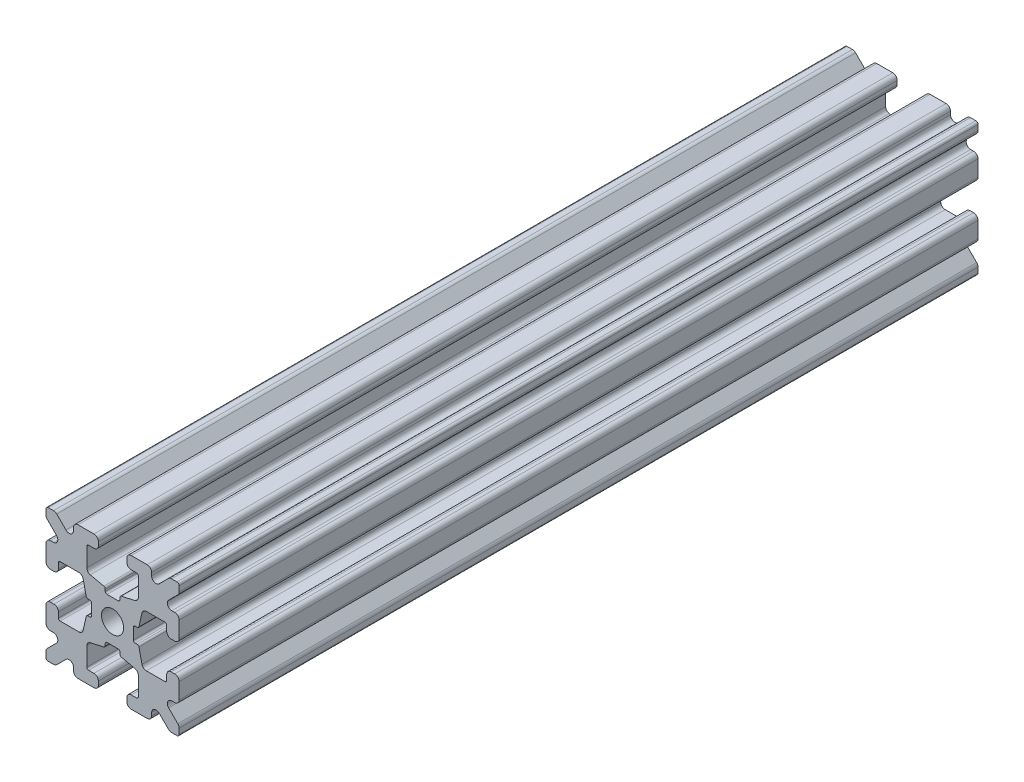
from build123d import *

# Parameters (mm, degrees)
SKETCH1_W           = 15
SKETCH1_H           = 15
SKETCH1_R           = 1.25
BOSS_EXTRUDE1_DEPTH = 45
FILLET1_R           = 0.25
CUT_EXTRUDE1_DEPTH  = 91.622844802
CUT_EXTRUDE3_DEPTH  = 91.622844802
FILLET3_R           = 0.5
FILLET4_R           = 0.5
FILLET5_R           = 3
FILLET6_R           = 0.2
CUT_EXTRUDE4_DEPTH  = 91.622844802
FILLET8_R           = 0.5
SKETCH6_W           = 5.1529354
SKETCH6_H           = 1.651
SKETCH6_W_2         = 1.651
SKETCH6_H_2         = 5.1529354
CUT_EXTRUDE5_DEPTH  = 91.622844802
FILLET10_R          = 0.2


with BuildPart() as part:
    # Sketch1 → Boss-Extrude1 (new, symmetric)
    with BuildSketch(Plane.XY):
        Rectangle(SKETCH1_W, SKETCH1_H)
        Circle(SKETCH1_R, mode=Mode.SUBTRACT)
    extrude(amount=BOSS_EXTRUDE1_DEPTH, both=True)

    # Fillet1
    fillet1_edges = [part.edges().sort_by_distance(p)[0] for p in [
        (7.5, -7.5, 0),
        (-7.5, -7.5, 0),
        (-7.5, 7.5, 0),
        (7.5, 7.5, 0),
    ]]
    fillet(fillet1_edges, radius=FILLET1_R)

    # Sketch2 → Cut-Extrude1 (cut, through all)
    with BuildSketch(Plane.XY.offset(45)):
        Polygon((-7.5, 1.6), (-6.1, 1.6), (-6.1, 2.9), (-3.4, 2.9), (-3.4, -2.9), (-6.1, -2.9), (-6.1, -1.6), (-7.5, -1.6), align=None)
        Polygon((2.9, 6.1), (1.6, 6.1), (1.6, 7.5), (-1.6, 7.5), (-1.6, 6.1), (-2.9, 6.1), (-2.9, 3.4), (2.9, 3.4), align=None)
        Polygon((-1.6, -7.5), (-1.6, -6.1), (-2.9, -6.1), (-2.9, -3.4), (2.9, -3.4), (2.9, -6.1), (1.6, -6.1), (1.6, -7.5), align=None)
        Polygon((6.1, -2.9), (6.1, -1.6), (7.5, -1.6), (7.5, 1.6), (6.1, 1.6), (6.1, 2.9), (3.4, 2.9), (3.4, -2.9), align=None)
    extrude(amount=-CUT_EXTRUDE1_DEPTH, mode=Mode.SUBTRACT)

    # Sketch4 → Cut-Extrude3 (cut, through all)
    with BuildSketch(Plane.XY.offset(45)):
        Polygon((-3.4, 2.9), (-2.75, 0), (-3.4, -2.9), align=None)
        Polygon((-2.9, 3.4), (0, 2.75), (2.9, 3.4), align=None)
        Polygon((3.4, 2.9), (2.75, 0), (3.4, -2.9), align=None)
        Polygon((-2.9, -3.4), (0, -2.75), (2.9, -3.4), align=None)
    extrude(amount=-CUT_EXTRUDE3_DEPTH, mode=Mode.SUBTRACT)

    # Fillet3
    fillet3_edges = [part.edges().sort_by_distance(p)[0] for p in [
        (1.6, -7.5, 0),
        (-1.6, -7.5, 0),
        (-1.6, -6.1, 0),
        (1.6, -6.1, 0),
        (6.1, 1.6, 0),
        (7.5, 1.6, 0),
        (7.5, -1.6, 0),
        (6.1, -1.6, 0),
        (-7.5, -1.6, 0),
        (-7.5, 1.6, 0),
        (-6.1, 1.6, 0),
        (-6.1, -1.6, 0),
        (-1.6, 6.1, 0),
        (-1.6, 7.5, 0),
        (1.6, 7.5, 0),
        (1.6, 6.1, 0),
    ]]
    fillet(fillet3_edges, radius=FILLET3_R)

    # Fillet4
    fillet4_edges = [part.edges().sort_by_distance(p)[0] for p in [
        (-2.9, -3.4, 0),
        (2.9, -3.4, 0),
        (3.4, -2.9, 0),
        (3.4, 2.9, 0),
        (-3.4, 2.9, 0),
        (-3.4, -2.9, 0),
        (2.9, 3.4, 0),
        (-2.9, 3.4, 0),
    ]]
    fillet(fillet4_edges, radius=FILLET4_R)

    # Fillet5
    fillet5_edges = [part.edges().sort_by_distance(p)[0] for p in [
        (-2.75, 0, 0),
        (0, 2.75, 0),
        (2.75, 0, 0),
        (0, -2.75, 0),
    ]]
    fillet(fillet5_edges, radius=FILLET5_R)

    # Fillet6
    fillet6_edges = [part.edges().sort_by_distance(p)[0] for p in [
        (-2.9, -6.1, 0),
        (2.9, -6.1, 0),
        (6.1, -2.9, 0),
        (6.1, 2.9, 0),
        (-6.1, 2.9, 0),
        (-6.1, -2.9, 0),
        (2.9, 6.1, 0),
        (-2.9, 6.1, 0),
    ]]
    fillet(fillet6_edges, radius=FILLET6_R)

    # Sketch5 → Cut-Extrude4 (cut, through all)
    with BuildSketch(Plane.XY.offset(45)):
        Polygon((-7.5, 6.439339828), (-5.460660172, 4.4), (-7.5, 4.4), align=None)
        Polygon((-6.439339828, 7.5), (-4.4, 5.460660172), (-4.4, 7.5), align=None)
        Polygon((4.4, 7.5), (6.439339828, 7.5), (4.4, 5.460660172), align=None)
        Polygon((7.5, 6.439339828), (7.5, 4.4), (5.460660172, 4.4), align=None)
        Polygon((7.5, -6.439339828), (5.460660172, -4.4), (7.5, -4.4), align=None)
        Polygon((6.439339828, -7.5), (4.4, -5.460660172), (4.4, -7.5), align=None)
        Polygon((-4.4, -7.5), (-6.439339828, -7.5), (-4.4, -5.460660172), align=None)
        Polygon((-7.5, -6.439339828), (-7.5, -4.4), (-5.460660172, -4.4), align=None)
    extrude(amount=-CUT_EXTRUDE4_DEPTH, mode=Mode.SUBTRACT)

    # Fillet8
    fillet8_edges = [part.edges().sort_by_distance(p)[0] for p in [
        (-7.5, 4.4, 0),
        (-7.5, 6.439339828, 0),
        (-5.460660172, 4.4, 0),
        (7.5, -4.4, 0),
        (7.5, -6.439339828, 0),
        (5.460660172, -4.4, 0),
        (5.460660172, 4.4, 0),
        (7.5, 6.439339828, 0),
        (7.5, 4.4, 0),
        (-4.4, 7.5, 0),
        (-4.4, 5.460660172, 0),
        (-6.439339828, 7.5, 0),
        (-5.460660172, -4.4, 0),
        (-7.5, -6.439339828, 0),
        (-7.5, -4.4, 0),
        (4.4, 5.460660172, 0),
        (4.4, 7.5, 0),
        (6.439339828, 7.5, 0),
        (6.439339828, -7.5, 0),
        (4.4, -7.5, 0),
        (4.4, -5.460660172, 0),
        (-6.439339828, -7.5, 0),
        (-4.4, -5.460660172, 0),
        (-4.4, -7.5, 0),
    ]]
    fillet(fillet8_edges, radius=FILLET8_R)

    # Sketch6 → Cut-Extrude5 (cut, through all)
    with BuildSketch(Plane.XY.offset(45)):
        with Locations((4.9235323, 0)):
            Rectangle(SKETCH6_W, SKETCH6_H)
        with Locations((0, -4.9235323)):
            Rectangle(SKETCH6_W_2, SKETCH6_H_2)
        with Locations((-4.9235323, 0)):
            Rectangle(SKETCH6_W, SKETCH6_H)
        with Locations((0, 4.9235323)):
            Rectangle(SKETCH6_W_2, SKETCH6_H_2)
    extrude(amount=-CUT_EXTRUDE5_DEPTH, mode=Mode.SUBTRACT)

    # Fillet10
    fillet10_edges = [part.edges().sort_by_distance(p)[0] for p in [
        (0.8255, -2.935025862, 0),
        (-0.8255, -2.935025862, 0),
        (0.8255, -2.3470646, 0),
        (-0.8255, -2.3470646, 0),
        (2.935025862, 0.8255, 0),
        (2.935025862, -0.8255, 0),
        (2.3470646, 0.8255, 0),
        (2.3470646, -0.8255, 0),
        (-2.935025862, -0.8255, 0),
        (-2.935025862, 0.8255, 0),
        (-2.3470646, -0.8255, 0),
        (-2.3470646, 0.8255, 0),
        (-0.8255, 2.935025862, 0),
        (0.8255, 2.935025862, 0),
        (-0.8255, 2.3470646, 0),
        (0.8255, 2.3470646, 0),
    ]]
    fillet(fillet10_edges, radius=FILLET10_R)


solid = part.part
